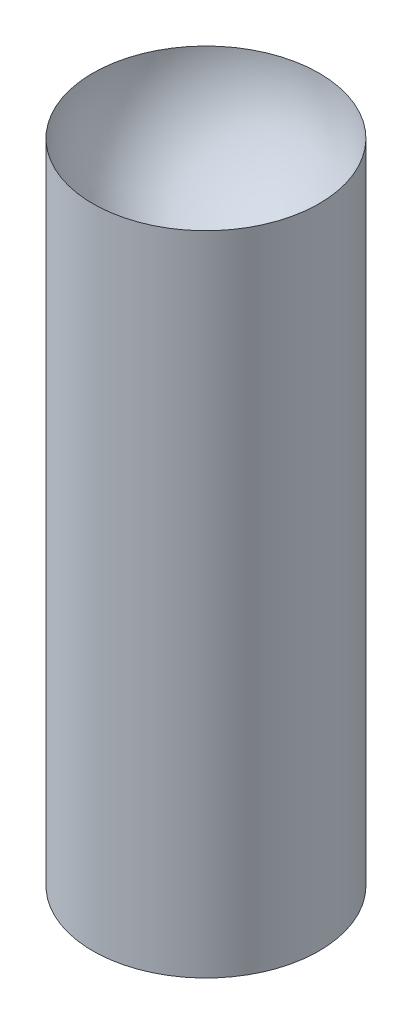
from build123d import *


with BuildPart() as part:
    # Sketch2 → Revolve1 (revolve)
    with BuildSketch(Plane(origin=(0, 0, 0), x_dir=(0, 0, -1), z_dir=(1, 0, 0))):
        with BuildLine():
            Line((0, 0), (2.5, 0))
            Line((2.5, 0), (2.5, 14.3))
            ThreePointArc((2.5, 14.3), (1.767766953, 12.532233047), (0, 11.8))
            Line((0, 11.8), (0, 0))
        make_face()
    revolve(axis=Axis((0, 0, 0), (0, 1, 0)))


solid = part.part
